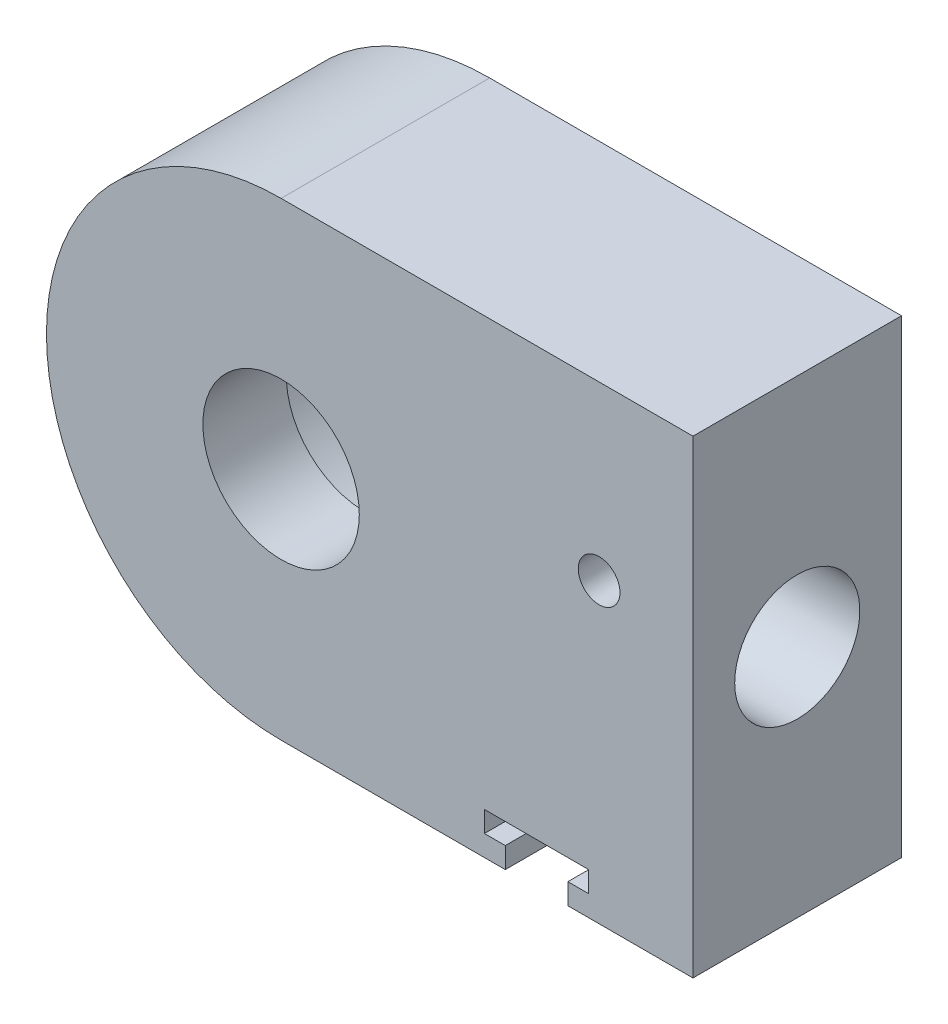
from build123d import *

# Parameters (mm, degrees)
ESQUISSE1_R                  = 7.5
BOSS_EXTRU_1_DEPTH           = 10
ESQUISSE1_3_W                = 17
ESQUISSE1_3_H                = 6
ENL_V_MAT_EXTRU_1_DEPTH      = 2
ENL_V_MAT_EXTRU_1_DEPTH_BACK = 10
ESQUISSE1_5_R                = 14
ENL_V_MAT_EXTRU_2_DEPTH      = 658.559578744
ENL_V_MAT_EXTRU_2_DEPTH_BACK = 658.559578744
ESQUISSE1_6_R                = 2
ENL_V_MAT_EXTRU_3_DEPTH      = 658.559578745
ENL_V_MAT_EXTRU_3_DEPTH_BACK = 658.559578745


with BuildPart() as part:
    # Esquisse1 → Boss.-Extru.1 (new, symmetric)
    with BuildSketch(Plane.XY):
        with BuildLine():
            Line((-634.508066615, 20), (-595.008671928, 20))
            Line((-595.008671928, 20), (-595.008671928, -25))
            Line((-595.008671928, -25), (-634.508066615, -25))
            ThreePointArc((-634.508066615, -25), (-657.008066615, -2.5), (-634.508066615, 20))
        make_face()
        with Locations((-634.508066615, -2.5)):
            Circle(ESQUISSE1_R, mode=Mode.SUBTRACT)
    extrude(amount=BOSS_EXTRU_1_DEPTH, both=True)

    # Esquisse1<3> → Enlèvement de matière-Révolution1 (revolve, cut)
    with BuildSketch(Plane.XY):
        with Locations((-603.508671928, 0.5)):
            Rectangle(ESQUISSE1_3_W, ESQUISSE1_3_H)
    revolve(axis=Axis((-666.113025571, -2.5, 0), (1, 0, 0)), mode=Mode.SUBTRACT)

    # Esquisse1<5> → Enlèv. mat.-Extru.1 (cut, two sides: drawn at the far end of the back side and taken through both)
    with BuildSketch(Plane.XY.offset(-ENL_V_MAT_EXTRU_1_DEPTH_BACK)):
        with Locations((-634.508066615, -2.5)):
            Circle(ESQUISSE1_5_R)
    extrude(amount=ENL_V_MAT_EXTRU_1_DEPTH + ENL_V_MAT_EXTRU_1_DEPTH_BACK, mode=Mode.SUBTRACT)

    # Esquisse1<6> → Enlèv. mat.-Extru.2 (cut, two sides: drawn at the far end of the back side and taken through both)
    with BuildSketch(Plane.XY.offset(-ENL_V_MAT_EXTRU_2_DEPTH_BACK)):
        with Locations((-604.008671928, 3.5)):
            Circle(ESQUISSE1_6_R)
    extrude(amount=ENL_V_MAT_EXTRU_2_DEPTH + ENL_V_MAT_EXTRU_2_DEPTH_BACK, mode=Mode.SUBTRACT)

    # Esquisse1<8> → Enlèv. mat.-Extru.3 (cut, two sides: drawn at the far end of the back side and taken through both)
    with BuildSketch(Plane.XY.offset(-ENL_V_MAT_EXTRU_3_DEPTH_BACK)):
        Polygon((-613.008671928, -23), (-613.008671928, -25), (-607.008671928, -25), (-607.008671928, -23), (-605.008671928, -23), (-605.008671928, -21), (-615.008671928, -21), (-615.008671928, -23), align=None)
    extrude(amount=ENL_V_MAT_EXTRU_3_DEPTH + ENL_V_MAT_EXTRU_3_DEPTH_BACK, mode=Mode.SUBTRACT)


solid = part.part
